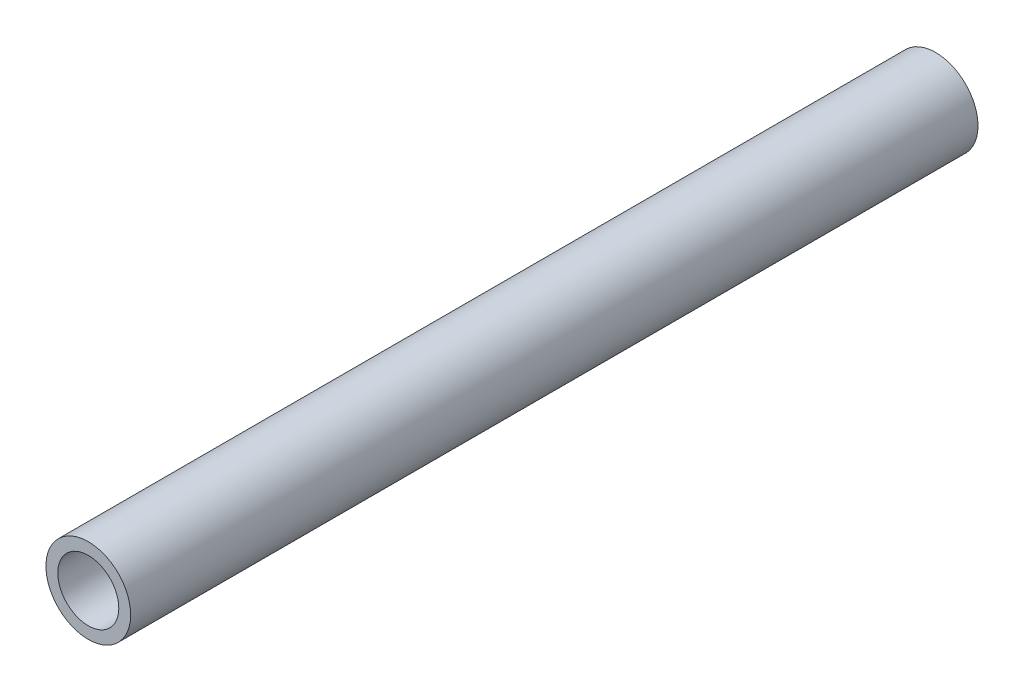
from build123d import *

# Parameters (mm, degrees)
SKETCH1_R           = 3.175
SKETCH1_R_2         = 2.286
BOSS_EXTRUDE1_DEPTH = 63.5


with BuildPart() as part:
    # Sketch1 → Boss-Extrude1 (new body)
    with BuildSketch(Plane.XY):
        Circle(SKETCH1_R)
        Circle(SKETCH1_R_2, mode=Mode.SUBTRACT)
    extrude(amount=BOSS_EXTRUDE1_DEPTH)


solid = part.part
